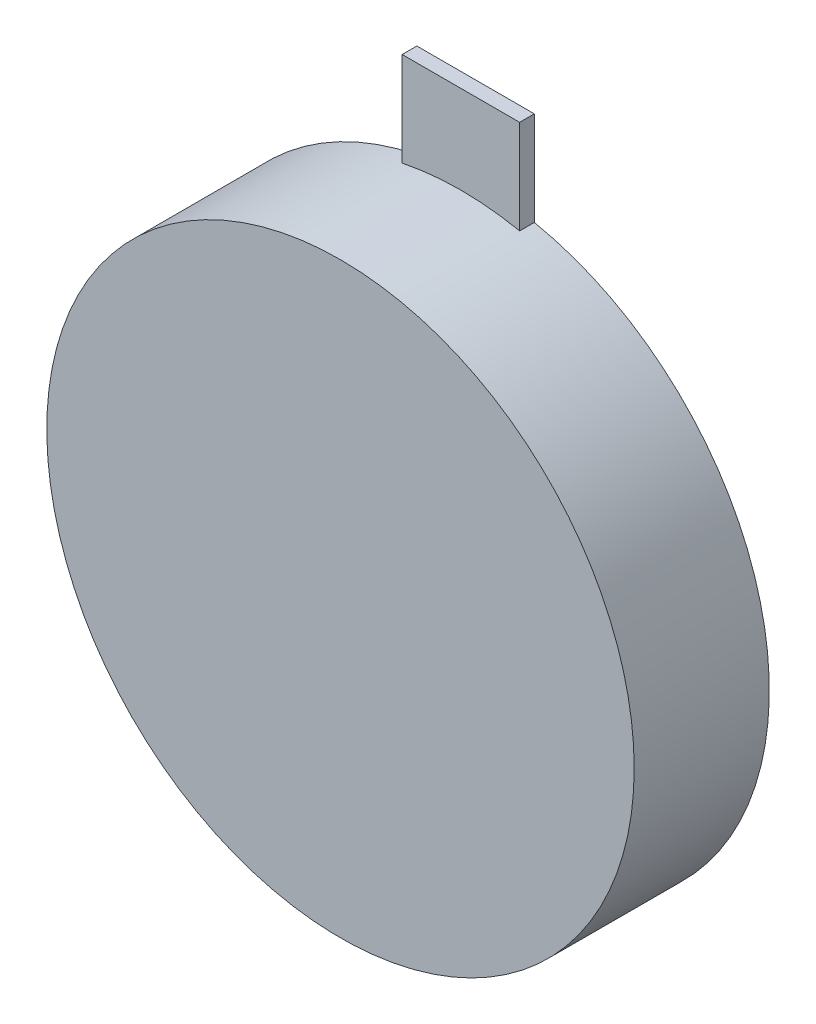
from build123d import *

# Parameters (mm, degrees)
SKETCH_230_R          = 7.3
EXTRUDE_254_DEPTH     = 0.5
SKETCH_305_R          = 10
EXTRUDE_323_DEPTH     = 4.6
SKETCH_364_W          = 4
SKETCH_364_H          = 4
EXTRUDE_412_DEPTH     = 0.5
SKETCH_471_W          = 0.267477204
SKETCH_471_H          = 0.791286728
SKETCH_471_W_2        = 0.261904762
SKETCH_471_H_2        = 2.691489362
SKETCH_471_W_3        = 0.490374874
SKETCH_471_H_3        = 3.722391084
SKETCH_471_W_4        = 0.373353597
SKETCH_471_H_4        = 2.59118541
CUT_EXTRUDE_814_DEPTH = 0.3


with BuildPart() as part:
    # Sketch 230 → Extrude 254 (new body)
    with BuildSketch(Plane.XY.offset(7.6)):
        with Locations((15, -35)):
            Circle(SKETCH_230_R)
    extrude(amount=EXTRUDE_254_DEPTH)

    # Sketch 305 → Extrude 323 (add)
    with BuildSketch(Plane.XY.offset(8.1)):
        with Locations((15, -35)):
            Circle(SKETCH_305_R)
    extrude(amount=EXTRUDE_323_DEPTH)

    # Sketch 364 → Extrude 412 (add)
    with BuildSketch(Plane.XY.offset(8.1)):
        with Locations((15, -24)):
            Rectangle(SKETCH_364_W, SKETCH_364_H)
    extrude(amount=EXTRUDE_412_DEPTH)

    # Sketch 471 → Cut-Extrude 814 (cut)
    # profile 1 of 6: a face of its own
    with BuildSketch(Plane.XY.offset(7.6)):
        Polygon((19.076241135, -35.76621074), (19.076241135, -33.793566363), (18.312816616, -33.793566363), (18.312816616, -33.386778116), (19.115248227, -33.386778116), (19.115248227, -32.72922999), (18.312816616, -32.72922999), (18.312816616, -32.25), (17.75, -32.25), (17.75, -32.72922999), (16.953140831, -32.72922999), (16.953140831, -33.386778116), (17.75, -33.386778116), (17.75, -33.793566363), (16.98100304, -33.793566363), (16.98100304, -35.76621074), (17.75, -35.76621074), (17.75, -36.156281662), (17.426798379, -35.877659574), (17.33407914, -35.968211753), (17.234239559, -36.068980074), (17.127279635, -36.179964539), (17.01319937, -36.301165147), (16.891998762, -36.432581898), (16.763677812, -36.574214792), (17.198328267, -36.98100304), (17.284855905, -36.871102105), (17.373550602, -36.760582011), (17.464412361, -36.649442756), (17.55744118, -36.537684341), (17.65263706, -36.425306766), (17.75, -36.31231003), (17.75, -37.738855117), (18.312816616, -37.738855117), (18.312816616, -36.529635258), (18.423646291, -36.723277609), (18.540667567, -36.910418777), (18.663880446, -37.091058764), (18.793284926, -37.265197568), (18.928881009, -37.432835191), (19.070668693, -37.593971631), (19.117570078, -37.471997073), (19.165400203, -37.351260835), (19.214159068, -37.231762918), (19.263846673, -37.113503321), (19.314463019, -36.996482044), (19.366008105, -36.880699088), (19.200227964, -36.729004841), (19.040949004, -36.563689069), (18.888171226, -36.384751773), (18.74189463, -36.192192953), (18.602119216, -35.986012608), (18.468844985, -35.76621074), align=None)
        with Locations((17.616261398, -34.779888551)):
            Rectangle(SKETCH_471_W, SKETCH_471_H, mode=Mode.SUBTRACT)
        with Locations((18.443768997, -34.779888551)):
            Rectangle(SKETCH_471_W_2, SKETCH_471_H, mode=Mode.SUBTRACT)
    # profile 2 of 6: a face of its own
    with BuildSketch(Plane.XY.offset(7.6)):
        Polygon((19.260131712, -32.640070922), (19.260131712, -36.590932118), (20.023556231, -36.590932118), (20.023556231, -37.153748734), (20.541793313, -37.153748734), (20.541793313, -32.640070922), align=None)
        with Locations((19.889817629, -34.61550152)):
            Rectangle(SKETCH_471_W, SKETCH_471_H_2, mode=Mode.SUBTRACT)
    # profile 3 of 6: a face of its own
    with BuildSketch(Plane.XY.offset(7.6)):
        Polygon((16.000253293, -32.25), (15.426291793, -32.25), (15.426291793, -37.020010132), (15.442544748, -37.211485422), (15.491303614, -37.369835641), (15.572568389, -37.49506079), (15.686339075, -37.587160869), (15.83261567, -37.646135878), (16.011398176, -37.671985816), (16.735815603, -37.671985816), (16.749127547, -37.546760666), (16.763058651, -37.427417539), (16.777608916, -37.313956434), (16.792778341, -37.20637735), (16.808566926, -37.104680288), (16.824974671, -37.008865248), (16.750056287, -37.017688281), (16.670184622, -37.025582573), (16.585359676, -37.032548126), (16.495581448, -37.038584938), (16.400849938, -37.043693009), (16.301165147, -37.04787234), (16.209219858, -37.040442418), (16.133991895, -37.018152651), (16.075481256, -36.98100304), (16.033687943, -36.928993583), (16.008611955, -36.862124282), (16.000253293, -36.780395137), align=None)
    # profile 4 of 6: a face of its own
    with BuildSketch(Plane.XY.offset(7.6)):
        with Locations((16.512917933, -34.646149949)):
            Rectangle(SKETCH_471_W_3, SKETCH_471_H_3)
    # profile 5 of 6: a face of its own
    with BuildSketch(Plane.XY.offset(7.6)):
        Polygon((14.835612969, -32.595491388), (13.102583587, -32.595491388), (13.102583587, -36.323454914), (12.916061578, -35.878123945), (12.765141281, -35.355707531), (12.649822695, -34.756205674), (12.57010582, -34.079618372), (12.525990656, -33.325945626), (12.517477204, -32.495187437), (11.804204661, -32.556484296), (11.804204661, -33.084318361), (11.815349544, -33.583051897), (11.837639311, -34.052684904), (11.871073961, -34.493217382), (11.915653495, -34.90464933), (11.971377913, -35.28698075), (12.065799842, -35.743920973), (12.189322301, -36.18228639), (12.341945289, -36.602077001), (12.523668806, -37.003292806), (12.734492852, -37.385933806), (12.974417427, -37.75), (13.039274457, -37.671676236), (13.118681752, -37.581588427), (13.212639311, -37.479736575), (13.321147135, -37.36612068), (13.444205223, -37.240740741), (13.581813576, -37.103596758), (13.500084431, -36.991219183), (13.422070247, -36.876984127), (13.347771023, -36.760891591), (13.277186761, -36.642941574), (13.21031746, -36.523134076), (13.147163121, -36.401469098), (14.155775076, -36.401469098), (14.155775076, -36.752532928), (14.835612969, -36.752532928), align=None)
        with Locations((13.969098278, -34.498480243)):
            Rectangle(SKETCH_471_W_4, SKETCH_471_H_4, mode=Mode.SUBTRACT)
    # profile 6 of 6: a face of its own
    with BuildSketch(Plane.XY.offset(7.6)):
        Polygon((10.511398176, -32.34473151), (10.494526061, -33.312478892), (10.414190026, -34.194782168), (10.270390071, -34.991641337), (10.063126196, -35.7030564), (9.792398401, -36.329027356), (9.458206687, -36.869554205), (9.548449285, -36.996017674), (9.640858944, -37.126505685), (9.735435664, -37.261018237), (9.832179444, -37.39955533), (9.931090285, -37.542116965), (10.032168186, -37.688703141), (10.407379264, -37.041990319), (10.712006079, -36.301784307), (10.946048632, -35.468085106), (11.109506923, -34.540892716), (11.202380952, -33.520207137), (11.224670719, -32.406028369), align=None)
    extrude(amount=CUT_EXTRUDE_814_DEPTH, mode=Mode.SUBTRACT)


solid = part.part
